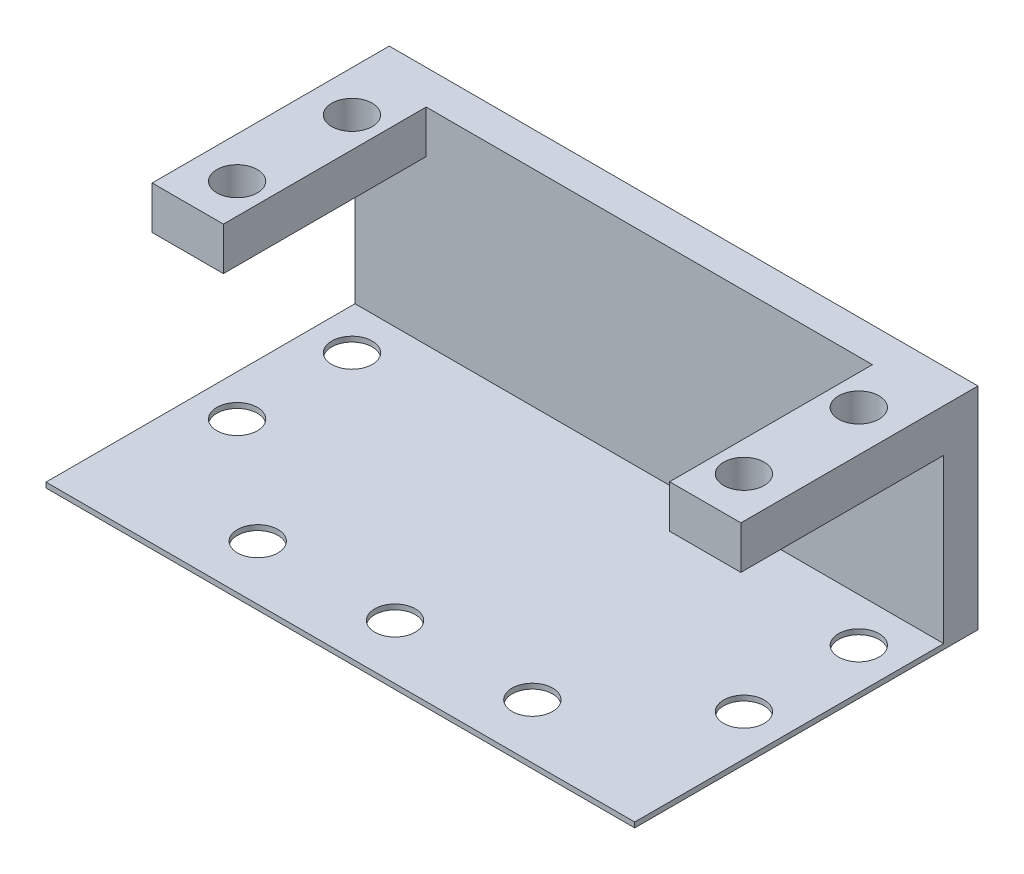
from build123d import *

# Parameters (mm, degrees)
SKETCH1_W           = 82.042
SKETCH1_H           = 50.8
BOSS_EXTRUDE1_DEPTH = 31.242
SKETCH2_W           = 66.04
SKETCH2_H           = 45.72
CUT_EXTRUDE1_DEPTH  = 30.48
SKETCH3_R           = 3
CUT_EXTRUDE2_DEPTH  = 58.479953071
SKETCH4_W           = 8.001
SKETCH4_H           = 15.711289628
CUT_EXTRUDE3_DEPTH  = 30.48
SKETCH5_R           = 3
CUT_EXTRUDE4_DEPTH  = 58.069368675
SKETCH6_W           = 30.008710372
SKETCH6_H           = 24.13
CUT_EXTRUDE5_DEPTH  = 92.389891826
BOSS_EXTRUDE2_DEPTH = 2.54
BOSS_EXTRUDE3_DEPTH = 2.54


with BuildPart() as part:
    # Sketch1 → Boss-Extrude1 (new body)
    with BuildSketch(Plane(origin=(0, 0, 0), x_dir=(1, 0, 0), z_dir=(0, 1, 0))):
        Rectangle(SKETCH1_W, SKETCH1_H)
    extrude(amount=BOSS_EXTRUDE1_DEPTH)

    # Sketch2 → Cut-Extrude1 (cut)
    with BuildSketch(Plane(origin=(0, 31.242, 0), x_dir=(1, 0, 0), z_dir=(0, 1, 0))):
        with Locations((0, -2.54)):
            Rectangle(SKETCH2_W, SKETCH2_H)
    extrude(amount=-CUT_EXTRUDE1_DEPTH, mode=Mode.SUBTRACT)

    # Sketch3 → Cut-Extrude2 (cut, through all)
    with BuildSketch(Plane(origin=(0, 31.242, 0), x_dir=(1, 0, 0), z_dir=(0, 1, 0))):
        with Locations(Location((-37.5, 13.82, 0), (0, 0, 270))):
            Circle(SKETCH3_R)
        with Locations(Location((-37.5, -3.18, 0), (0, 0, 270))):
            Circle(SKETCH3_R)
        with Locations(Location((37.5, 13.82, 0), (0, 0, 270))):
            Circle(SKETCH3_R)
        with Locations(Location((37.5, -3.18, 0), (0, 0, 270))):
            Circle(SKETCH3_R)
    extrude(amount=-CUT_EXTRUDE2_DEPTH, mode=Mode.SUBTRACT)

    # Sketch4 → Cut-Extrude3 (cut)
    with BuildSketch(Plane(origin=(0, 31.242, 0), x_dir=(1, 0, 0), z_dir=(0, 1, 0))):
        with Locations((-37.0205, -17.544355186)):
            Rectangle(SKETCH4_W, SKETCH4_H)
        with Locations((37.0205, -17.544355186)):
            Rectangle(SKETCH4_W, SKETCH4_H)
    extrude(amount=-CUT_EXTRUDE3_DEPTH, mode=Mode.SUBTRACT)

    # Sketch5 → Cut-Extrude4 (cut, through all)
    with BuildSketch(Plane(origin=(0, 0.762, 0), x_dir=(1, 0, 0), z_dir=(0, 1, 0))):
        with Locations(Location((0, -17.308710372, 0), (0, 0, 270))):
            Circle(SKETCH5_R)
        with Locations(Location((-20.32, -17.308710372, 0), (0, 0, 270))):
            Circle(SKETCH5_R)
        with Locations(Location((20.32, -17.308710372, 0), (0, 0, 270))):
            Circle(SKETCH5_R)
    extrude(amount=-CUT_EXTRUDE4_DEPTH, mode=Mode.SUBTRACT)

    # Sketch6 → Cut-Extrude5 (cut, through all)
    with BuildSketch(Plane(origin=(41.021, 0, 0), x_dir=(0, 0, -1), z_dir=(1, 0, 0))):
        with Locations((5.315644814, 12.827)):
            Rectangle(SKETCH6_W, SKETCH6_H)
    extrude(amount=-CUT_EXTRUDE5_DEPTH, mode=Mode.SUBTRACT)

    # Sketch8 → Boss-Extrude2 (add)
    with BuildSketch(Plane.ZY.offset(41.021)):
        Polygon((9.688710372, 24.892), (9.688710372, 31.242), (-25.4, 31.242), (-25.4, 0), (25.4, 0), (25.4, 0.762), (-20.32, 0.762), (-20.32, 24.892), align=None)
    extrude(amount=BOSS_EXTRUDE2_DEPTH)

    # Sketch9 → Boss-Extrude3 (add)
    with BuildSketch(Plane(origin=(41.021, 0, 0), x_dir=(0, 0, -1), z_dir=(1, 0, 0))):
        Polygon((-9.688710372, 31.242), (-9.688710372, 24.892), (20.32, 24.892), (20.32, 0.762), (-25.4, 0.762), (-25.4, 0), (25.4, 0), (25.4, 31.242), align=None)
    extrude(amount=BOSS_EXTRUDE3_DEPTH)


solid = part.part
